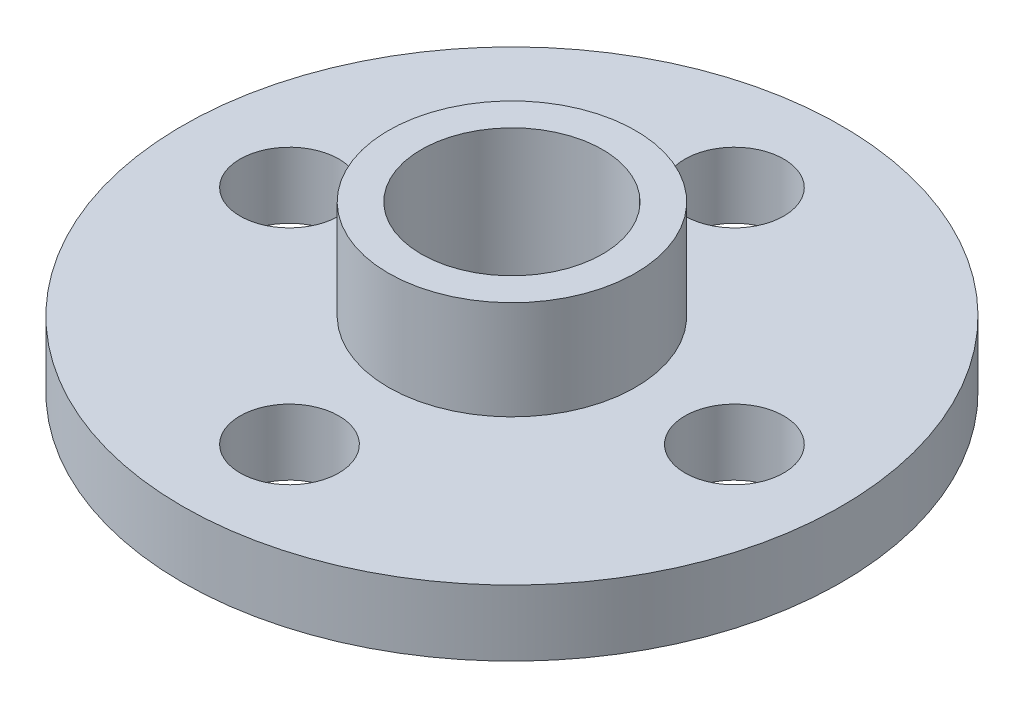
from build123d import *

# Parameters (mm, degrees)
SKETCH2_R           = 10
BOSS_EXTRUDE1_DEPTH = 2
SKETCH3_R           = 1.5
CUT_EXTRUDE1_DEPTH  = 15.282856857
SKETCH4_R           = 3.75
BOSS_EXTRUDE2_DEPTH = 3
SKETCH5_R           = 1.5
CUT_EXTRUDE2_DEPTH  = 16
SKETCH6_R           = 2.75
CUT_EXTRUDE3_DEPTH  = 4.5


with BuildPart() as part:
    # Sketch2 → Boss-Extrude1 (new body)
    with BuildSketch(Plane(origin=(0, 0, 0), x_dir=(1, 0, 0), z_dir=(0, 1, 0))):
        with Locations(Location((0, 0, 0), (0, 0, 270))):
            Circle(SKETCH2_R)
    extrude(amount=BOSS_EXTRUDE1_DEPTH)

    # Sketch3 → Cut-Extrude1 (cut, through all)
    with BuildSketch(Plane(origin=(0, 2, 0), x_dir=(1, 0, 0), z_dir=(0, 1, 0))):
        with Locations(Location((0, 6.75, 0), (0, 0, 270))):
            Circle(SKETCH3_R)
        with Locations(Location((6.75, 0, 0), (0, 0, 270))):
            Circle(SKETCH3_R)
        with Locations(Location((0, -6.75, 0), (0, 0, 90))):
            Circle(SKETCH3_R)
        with Locations(Location((-6.75, 0, 0), (0, 0, 90))):
            Circle(SKETCH3_R)
    extrude(amount=-CUT_EXTRUDE1_DEPTH, mode=Mode.SUBTRACT)

    # Sketch4 → Boss-Extrude2 (add)
    with BuildSketch(Plane(origin=(0, 2, 0), x_dir=(1, 0, 0), z_dir=(0, 1, 0))):
        with Locations(Location((0, 0, 0), (0, 0, 270))):
            Circle(SKETCH4_R)
    extrude(amount=BOSS_EXTRUDE2_DEPTH)

    # Sketch5 → Cut-Extrude2 (cut, through all)
    with BuildSketch(Plane(origin=(0, 5, 0), x_dir=(1, 0, 0), z_dir=(0, 1, 0))):
        with Locations(Location((0, 0, 0), (0, 0, 270))):
            Circle(SKETCH5_R)
    extrude(amount=-CUT_EXTRUDE2_DEPTH, mode=Mode.SUBTRACT)

    # Sketch6 → Cut-Extrude3 (cut)
    with BuildSketch(Plane(origin=(0, 5, 0), x_dir=(1, 0, 0), z_dir=(0, 1, 0))):
        with Locations(Location((0, 0, 0), (0, 0, 270))):
            Circle(SKETCH6_R)
    extrude(amount=-CUT_EXTRUDE3_DEPTH, mode=Mode.SUBTRACT)


solid = part.part
